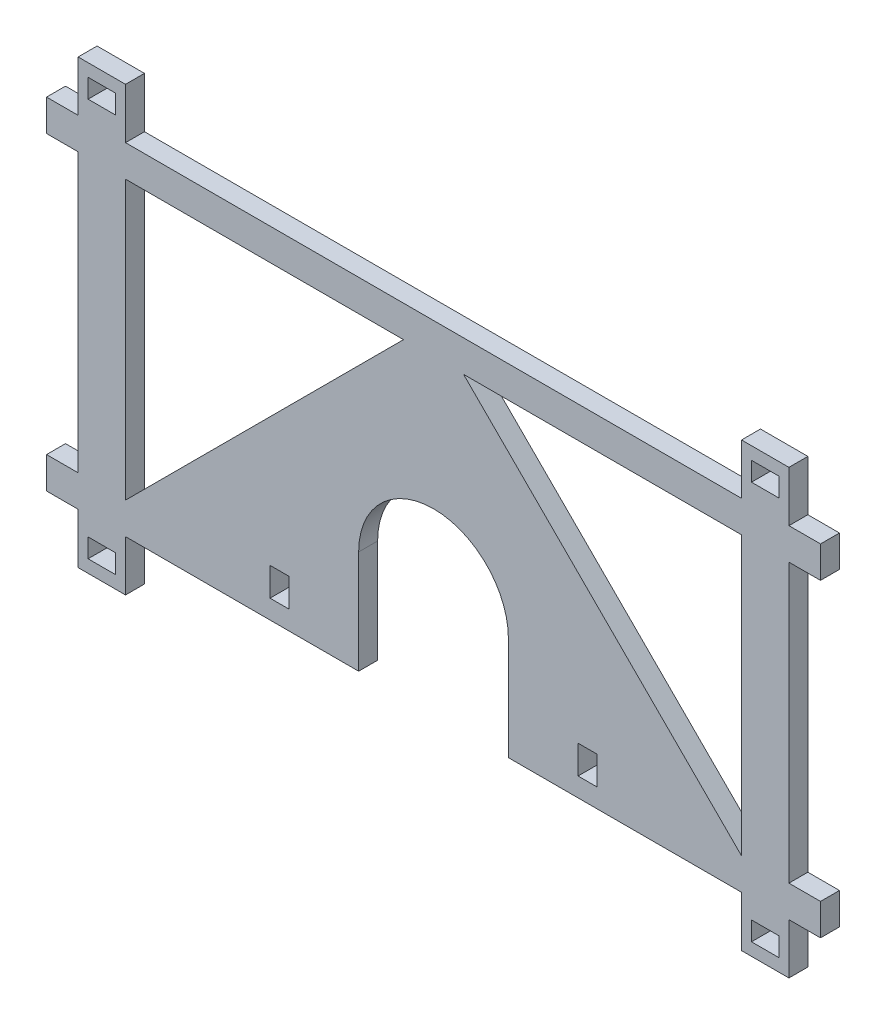
from build123d import *

# Parameters (mm, degrees)
BOSS_EXTRUDE1_DEPTH = 5.08
CUT_EXTRUDE2_DEPTH  = 226.023867672
CUT_EXTRUDE4_DEPTH  = 226.023867672
CUT_EXTRUDE5_DEPTH  = 226.023867672
CUT_EXTRUDE6_DEPTH  = 226.023867672


with BuildPart() as part:
    # Sketch1 → Boss-Extrude1 (new body)
    with BuildSketch(Plane.XY):
        Polygon((198.966666667, 91.44), (198.966666667, 82.973333333), (190.5, 82.973333333), (190.5, 8.466666667), (198.966666667, 8.466666667), (198.966666667, 0), (190.5, 0), (190.5, -13.546666667), (177.8, -13.546666667), (177.8, 0), (12.7, 0), (12.7, -13.546666667), (0, -13.546666667), (0, 0), (-8.466666667, 0), (-8.466666667, 8.466666667), (0, 8.466666667), (0, 82.973333333), (-8.466666667, 82.973333333), (-8.466666667, 91.44), (0, 91.44), (0, 104.986666667), (12.7, 104.986666667), (12.7, 91.44), (177.8, 91.44), (177.8, 104.986666667), (190.5, 104.986666667), (190.5, 91.44), align=None)
    extrude(amount=BOSS_EXTRUDE1_DEPTH)

    # Sketch2 → Cut-Extrude2 (cut, through all)
    with BuildSketch(Plane.XY.offset(5.08)):
        with BuildLine():
            Line((95.25, 0), (115.316, 0))
            Line((115.316, 0), (115.316, 27.686))
            ThreePointArc((115.316, 27.686), (95.25, 47.752), (75.184, 27.686))
            Line((75.184, 27.686), (75.184, 0))
            Line((75.184, 0), (95.25, 0))
        make_face()
    extrude(amount=-CUT_EXTRUDE2_DEPTH, mode=Mode.SUBTRACT)

    # Sketch3 → Cut-Extrude4 (cut, through all)
    with BuildSketch(Plane.XY.offset(5.08)):
        Polygon((6.35, 96.52), (10.033, 96.52), (10.033, 101.6), (2.667, 101.6), (2.667, 96.52), align=None)
        Polygon((184.15, 96.52), (187.833, 96.52), (187.833, 101.6), (180.467, 101.6), (180.467, 96.52), align=None)
        Polygon((184.15, -5.08), (187.833, -5.08), (187.833, -10.16), (180.467, -10.16), (180.467, -5.08), align=None)
        Polygon((6.35, -5.08), (10.033, -5.08), (10.033, -10.16), (2.667, -10.16), (2.667, -5.08), align=None)
    extrude(amount=-CUT_EXTRUDE4_DEPTH, mode=Mode.SUBTRACT)

    # Sketch4 → Cut-Extrude5 (cut, through all)
    with BuildSketch(Plane.XY.offset(5.08)):
        Polygon((136.525, 5.08), (139.065, 5.08), (139.065, 12.7), (133.985, 12.7), (133.985, 5.08), align=None)
        Polygon((53.975, 5.08), (56.515, 5.08), (56.515, 12.7), (51.435, 12.7), (51.435, 5.08), align=None)
    extrude(amount=-CUT_EXTRUDE5_DEPTH, mode=Mode.SUBTRACT)

    # Sketch5 → Cut-Extrude6 (cut, through all)
    with BuildSketch(Plane.XY.offset(5.08)):
        Polygon((12.7, 82.973333333), (12.7, 8.466666667), (87.206666667, 82.973333333), align=None)
    cut_extrude6 = extrude(amount=-CUT_EXTRUDE6_DEPTH, mode=Mode.SUBTRACT)

    # Mirror1: Cut-Extrude6 across plane
    add(cut_extrude6.mirror(Plane(origin=(95.25, 0, 0), x_dir=(0, 0, 1), z_dir=(1, 0, 0))), mode=Mode.SUBTRACT)


solid = part.part
